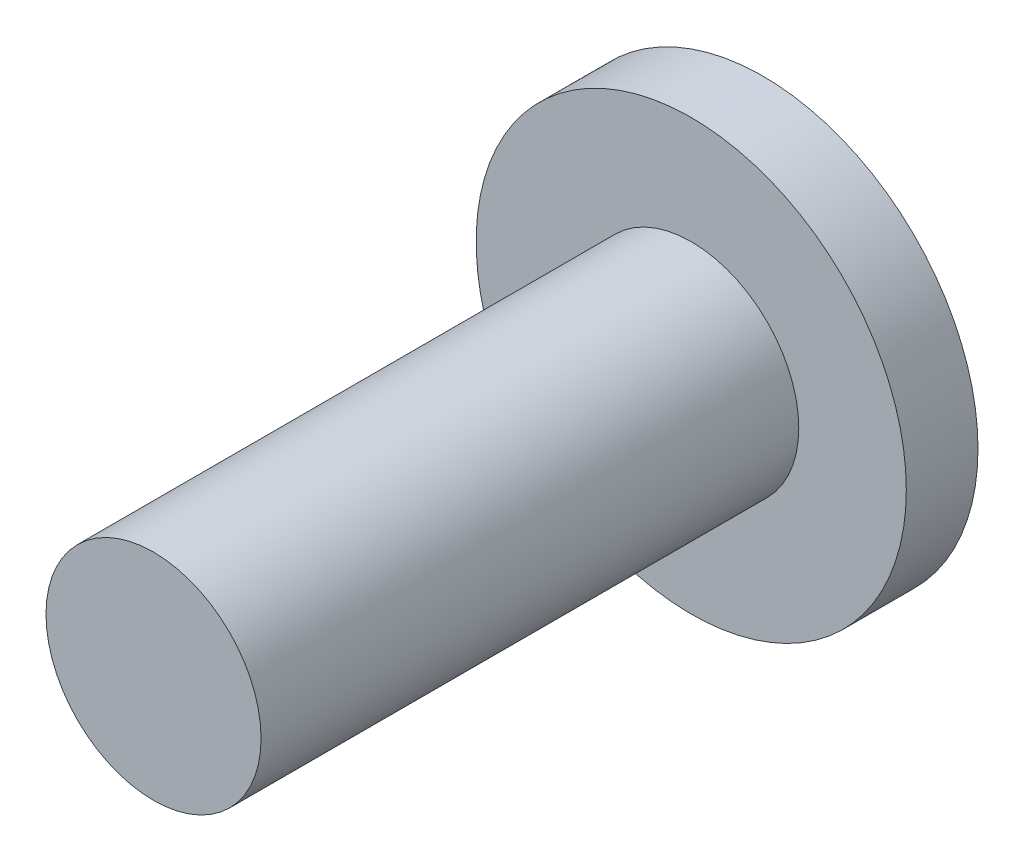
from build123d import *

# Parameters (mm, degrees)
SKETCH1_R           = 6
BOSS_EXTRUDE1_DEPTH = 2
SKETCH2_R           = 3
BOSS_EXTRUDE2_DEPTH = 15


with BuildPart() as part:
    # Sketch1 → Boss-Extrude1 (new body)
    with BuildSketch(Plane.XY):
        Circle(SKETCH1_R)
    extrude(amount=BOSS_EXTRUDE1_DEPTH)

    # Sketch2 → Boss-Extrude2 (add)
    with BuildSketch(Plane.XY.offset(2)):
        Circle(SKETCH2_R)
    extrude(amount=BOSS_EXTRUDE2_DEPTH)


solid = part.part
